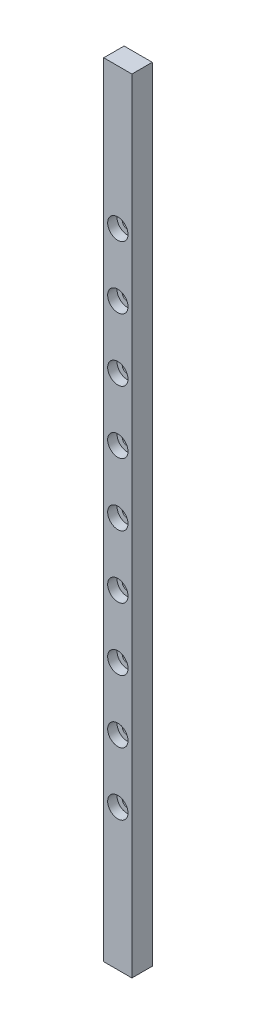
from build123d import *

# Parameters (mm, degrees)
SKETCH_1_W          = 9
SKETCH_1_H          = 250
EXTRUDE_1_DEPTH     = 6.5
SKETCH_2_R          = 1.6
CUT_EXTRUDE_1_DEPTH = 126.249750499
SKETCH_3_R          = 3.25
CUT_EXTRUDE_2_DEPTH = 3


with BuildPart() as part:
    # 草图1 → 凸台-拉伸1 (new body)
    with BuildSketch(Plane.XY):
        Rectangle(SKETCH_1_W, SKETCH_1_H)
    extrude(amount=EXTRUDE_1_DEPTH)

    # 草图2 → 切除-拉伸1 (cut, through all)
    with BuildSketch(Plane.XY.offset(6.5)):
        Circle(SKETCH_2_R)
        with Locations((0, 20)):
            Circle(SKETCH_2_R)
        with Locations((0, 40)):
            Circle(SKETCH_2_R)
        with Locations((0, 60)):
            Circle(SKETCH_2_R)
        with Locations((0, 80)):
            Circle(SKETCH_2_R)
        with Locations((0, -20)):
            Circle(SKETCH_2_R)
        with Locations((0, -40)):
            Circle(SKETCH_2_R)
        with Locations((0, -60)):
            Circle(SKETCH_2_R)
        with Locations((0, -80)):
            Circle(SKETCH_2_R)
    extrude(amount=-CUT_EXTRUDE_1_DEPTH, mode=Mode.SUBTRACT)

    # 草图3 → 切除-拉伸2 (cut)
    with BuildSketch(Plane.XY.offset(6.5)):
        with Locations((0, 80)):
            Circle(SKETCH_3_R)
        with Locations((0, 60)):
            Circle(SKETCH_3_R)
        with Locations((0, 40)):
            Circle(SKETCH_3_R)
        with Locations((0, 20)):
            Circle(SKETCH_3_R)
        Circle(SKETCH_3_R)
        with Locations((0, -20)):
            Circle(SKETCH_3_R)
        with Locations((0, -40)):
            Circle(SKETCH_3_R)
        with Locations((0, -60)):
            Circle(SKETCH_3_R)
        with Locations((0, -80)):
            Circle(SKETCH_3_R)
    extrude(amount=-CUT_EXTRUDE_2_DEPTH, mode=Mode.SUBTRACT)


solid = part.part
